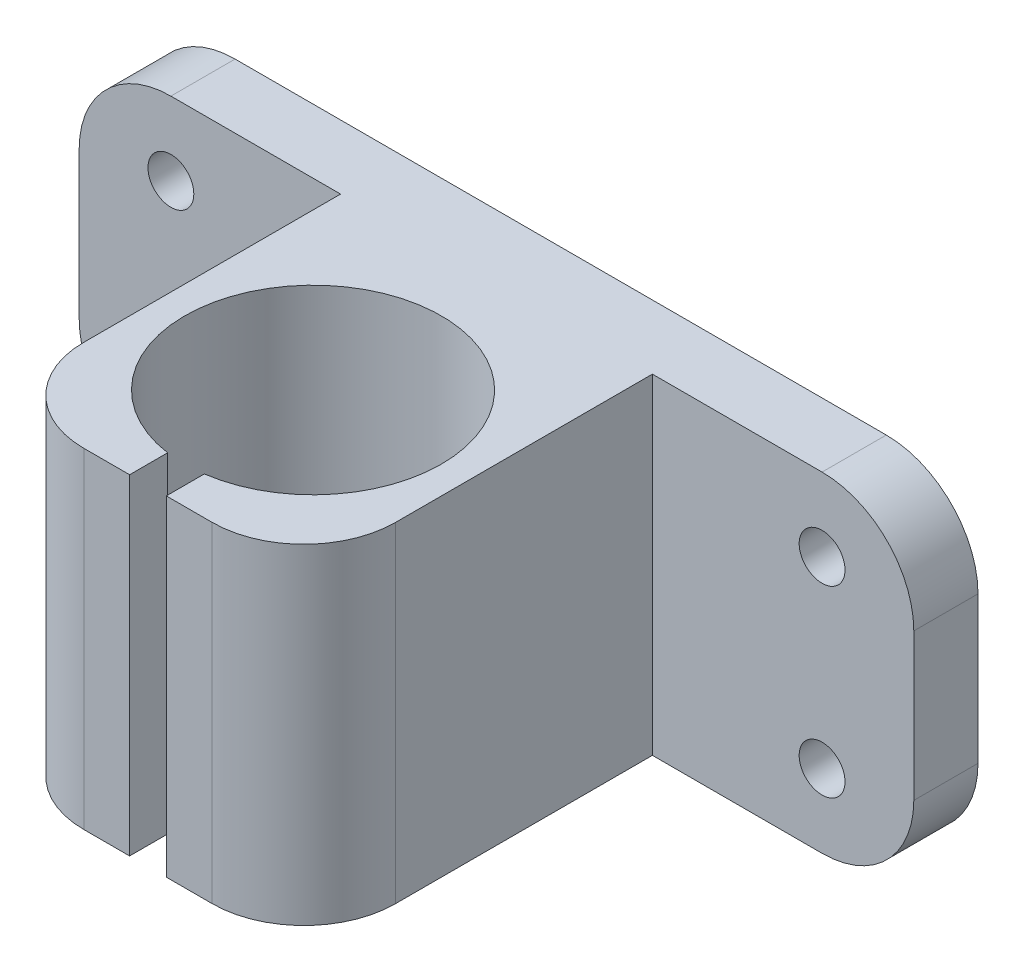
from build123d import *

# Parameters (mm, degrees)
EXTRUDE_1_DEPTH     = 7
SKETCH_2_R          = 2.5
CUT_EXTRUDE_1_DEPTH = 10
SKETCH_3_W          = 34
SKETCH_3_H          = 36
EXTRUDE_2_DEPTH     = 38
SKETCH_6_R          = 14
CUT_EXTRUDE_2_DEPTH = 40
SKETCH_8_W          = 4
SKETCH_8_H          = 36
CUT_EXTRUDE_3_DEPTH = 10
FILLET_1_R          = 10


with BuildPart() as part:
    # 草圖1 → 填料-伸長1 (new body)
    with BuildSketch(Plane.XY):
        with BuildLine():
            Line((35.5, -18), (-35.5, -18))
            ThreePointArc((-35.5, -18), (-42.571067812, -15.071067812), (-45.5, -8))
            Line((-45.5, -8), (-45.5, 8))
            ThreePointArc((-45.5, 8), (-42.571067812, 15.071067812), (-35.5, 18))
            Line((-35.5, 18), (35.5, 18))
            ThreePointArc((35.5, 18), (42.571067812, 15.071067812), (45.5, 8))
            Line((45.5, 8), (45.5, -8))
            ThreePointArc((45.5, -8), (42.571067812, -15.071067812), (35.5, -18))
        make_face()
    extrude(amount=EXTRUDE_1_DEPTH)

    # 草圖2 → 除料-伸長1 (cut)
    with BuildSketch(Plane.XY.offset(7)):
        with Locations((-35.5, 10)):
            Circle(SKETCH_2_R)
        with Locations((35.5, 10)):
            Circle(SKETCH_2_R)
        with Locations((35.5, -10)):
            Circle(SKETCH_2_R)
        with Locations((-35.5, -10)):
            Circle(SKETCH_2_R)
    extrude(amount=-CUT_EXTRUDE_1_DEPTH, mode=Mode.SUBTRACT)

    # 草圖3 → 填料-伸長2 (add)
    with BuildSketch(Plane.XY.offset(7)):
        Rectangle(SKETCH_3_W, SKETCH_3_H)
    extrude(amount=EXTRUDE_2_DEPTH)

    # 草圖6 → 除料-伸長2 (cut)
    with BuildSketch(Plane(origin=(0, 18, 0), x_dir=(1, 0, 0), z_dir=(0, 1, 0))):
        with Locations(Location((0, -27, 0), (0, 0, 180))):
            Circle(SKETCH_6_R)
    extrude(amount=-CUT_EXTRUDE_2_DEPTH, mode=Mode.SUBTRACT)

    # 草圖8 → 除料-伸長3 (cut)
    with BuildSketch(Plane.XY.offset(45)):
        Rectangle(SKETCH_8_W, SKETCH_8_H)
    extrude(amount=-CUT_EXTRUDE_3_DEPTH, mode=Mode.SUBTRACT)

    # 圓角1
    fillet_1_edges = [part.edges().sort_by_distance(p)[0] for p in [
        (-17, 0, 45),
        (17, 0, 45),
    ]]
    fillet(fillet_1_edges, radius=FILLET_1_R)


solid = part.part
